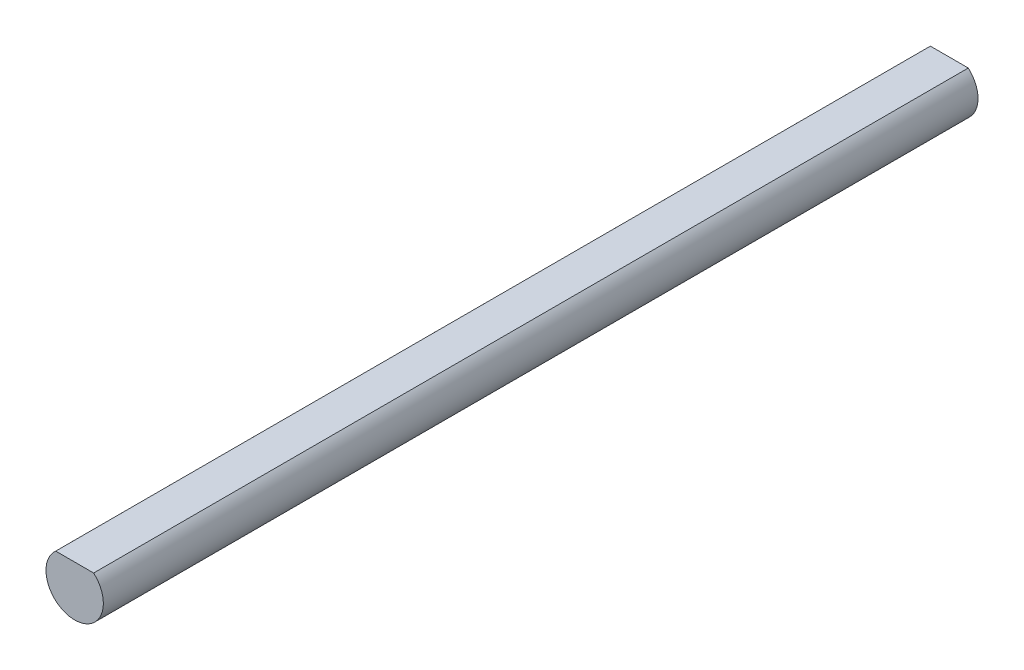
from build123d import *

# Parameters (mm, degrees)
BOSS_EXTRUDE1_DEPTH      = 61
BOSS_EXTRUDE1_DEPTH_BACK = 61
SKETCH1_R                = 4
CUT_EXTRUDE1_DEPTH       = 122


with BuildPart() as part:
    # Sketch1 → Boss-Extrude1 (new, two sides: drawn at the far end of the back side and taken through both)
    with BuildSketch(Plane.XY.offset(-BOSS_EXTRUDE1_DEPTH_BACK)):
        Circle(SKETCH1_R)
    extrude(amount=BOSS_EXTRUDE1_DEPTH + BOSS_EXTRUDE1_DEPTH_BACK)

    # Sketch2 → Cut-Extrude1 (cut)
    with BuildSketch(Plane.XY.offset(61)):
        with BuildLine():
            Line((-2.645751311, 3), (2.645751311, 3))
            ThreePointArc((2.645751311, 3), (0, 4), (-2.645751311, 3))
        make_face()
    extrude(amount=-CUT_EXTRUDE1_DEPTH, mode=Mode.SUBTRACT)


solid = part.part
